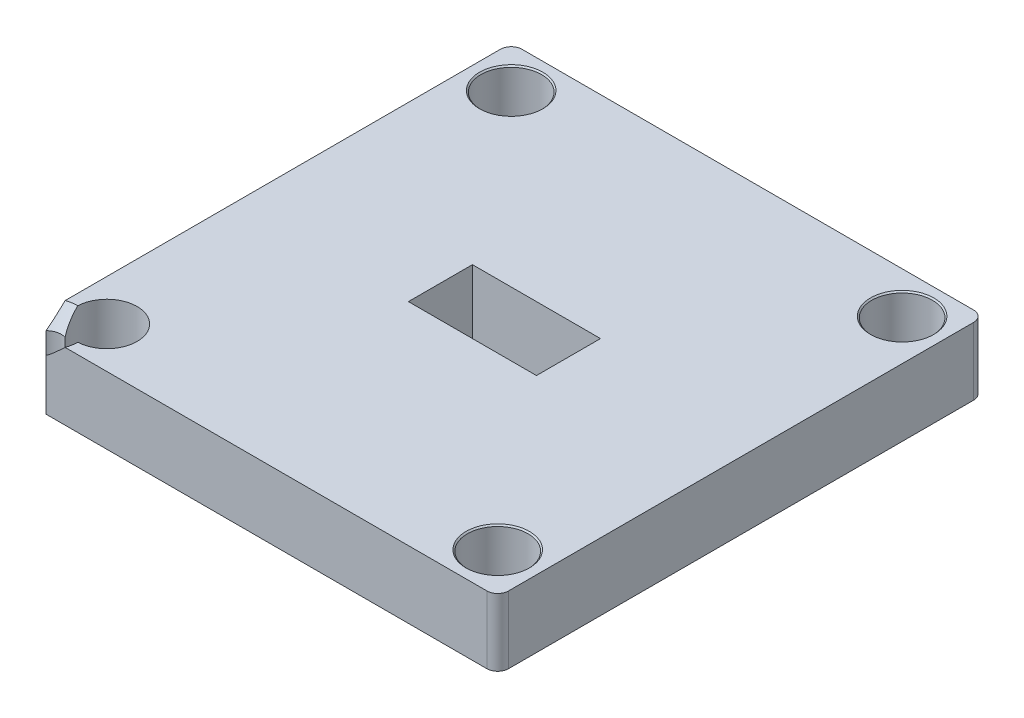
from build123d import *

# Parameters (mm, degrees)
SKETCH_2_R                  = 4.5
SKETCH_2_W                  = 19
SKETCH_2_H                  = 9.5
EXTRUDE_1_DEPTH             = 10
HOLE_WIZARD_M41_D           = 4.5
HOLE_WIZARD_M41_CSINK_D     = 9.4
HOLE_WIZARD_M41_CSINK_ANGLE = 90


with BuildPart() as part:
    # Эскиз2 → Бобышка-Вытянуть1 (new body)
    with BuildSketch(Plane(origin=(0, 0, 0), x_dir=(1, 0, 0), z_dir=(0, 1, 0))):
        with BuildLine():
            Line((33.5, -36.1), (-33.5, -36.1))
            ThreePointArc((-33.5, -36.1), (-34.63137085, -35.63137085), (-35.1, -34.5))
            Line((-35.1, -34.5), (-35.1, 34.5))
            ThreePointArc((-35.1, 34.5), (-34.63137085, 35.63137085), (-33.5, 36.1))
            Line((-33.5, 36.1), (33.5, 36.1))
            ThreePointArc((33.5, 36.1), (34.63137085, 35.63137085), (35.1, 34.5))
            Line((35.1, 34.5), (35.1, -34.5))
            ThreePointArc((35.1, -34.5), (34.63137085, -35.63137085), (33.5, -36.1))
        make_face()
        with Locations(Location((-29, 30, 0), (0, 0, 270))):
            Circle(SKETCH_2_R, mode=Mode.SUBTRACT)
        with Locations(Location((29, 30, 0), (0, 0, 270))):
            Circle(SKETCH_2_R, mode=Mode.SUBTRACT)
        with Locations(Location((29, -30, 0), (0, 0, 270))):
            Circle(SKETCH_2_R, mode=Mode.SUBTRACT)
        with Locations(Location((-29, -30, 0), (0, 0, 270))):
            Circle(SKETCH_2_R, mode=Mode.SUBTRACT)
        Rectangle(SKETCH_2_W, SKETCH_2_H, mode=Mode.SUBTRACT)
    extrude(amount=EXTRUDE_1_DEPTH)

    # Зенковка для винта с полупотайной головкой M41 (through all)
    with Locations(Plane(origin=(0, 10, 0), x_dir=(1, 0, 0), z_dir=(0, 1, 0))):
        with Locations((-29, 30), (29, 30), (-33.5, -34.5), (29, -30)):
            CounterSinkHole(HOLE_WIZARD_M41_D / 2, HOLE_WIZARD_M41_CSINK_D / 2, counter_sink_angle=HOLE_WIZARD_M41_CSINK_ANGLE)


solid = part.part
